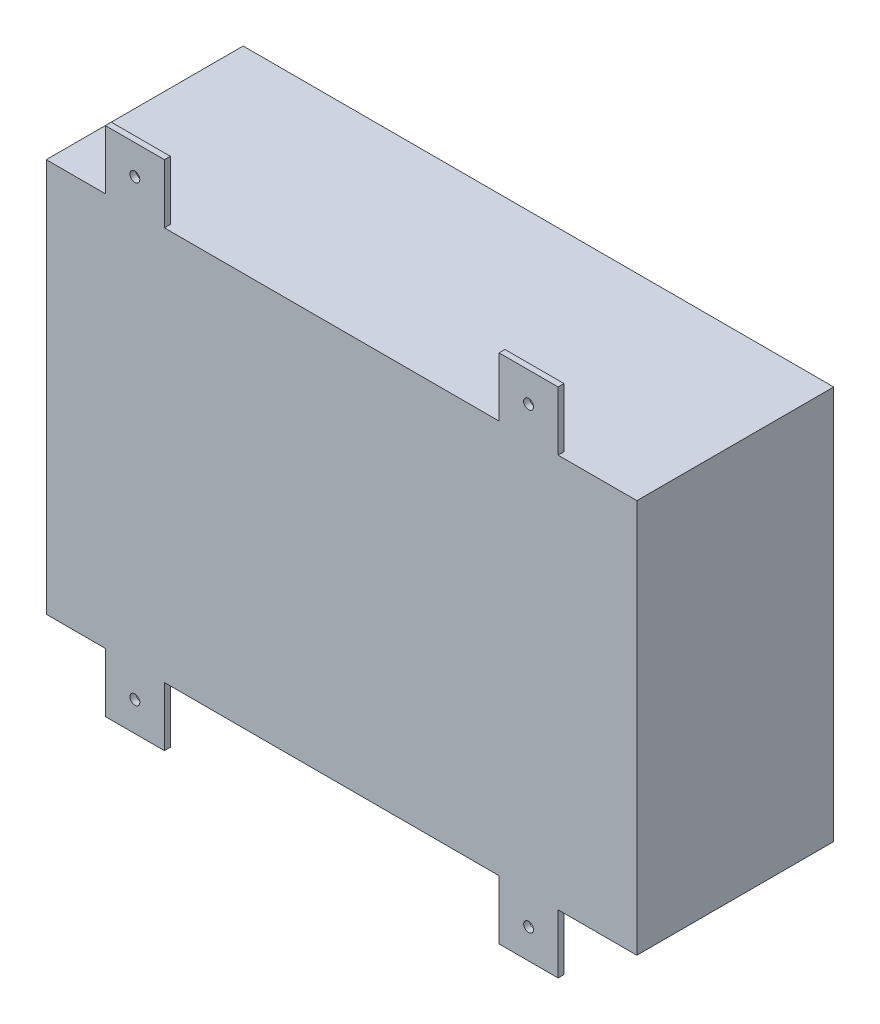
from build123d import *

# Parameters (mm, degrees)
SKETCH1_W           = 762
SKETCH1_H           = 508
SKETCH1_W_2         = 711.2
SKETCH1_H_2         = 457.2
BOSS_EXTRUDE1_DEPTH = 254
SKETCH2_W           = 711.2
SKETCH2_H           = 457.2
BOSS_EXTRUDE2_DEPTH = 25.4
SKETCH3_W           = 76.2
SKETCH3_H           = 76.2
SKETCH3_R           = 6.35
BOSS_EXTRUDE3_DEPTH = 7.62
SKETCH4_R           = 63.5
CUT_EXTRUDE1_DEPTH  = 133.096
SCALE1_SCALE        = 0.5


with BuildPart() as part:
    # Sketch1 → Boss-Extrude1 (new body)
    with BuildSketch(Plane.XY):
        Rectangle(SKETCH1_W, SKETCH1_H)
        Rectangle(SKETCH1_W_2, SKETCH1_H_2, mode=Mode.SUBTRACT)
    extrude(amount=BOSS_EXTRUDE1_DEPTH)

    # Sketch2 → Boss-Extrude2 (add)
    with BuildSketch(Plane.XY.offset(254)):
        Rectangle(SKETCH2_W, SKETCH2_H)
    extrude(amount=-BOSS_EXTRUDE2_DEPTH)

    # Sketch3 → Boss-Extrude3 (add)
    # profile 1 of 4: a face of its own
    with BuildSketch(Plane.XY.offset(254)):
        with Locations((-266.7, -292.1)):
            Rectangle(SKETCH3_W, SKETCH3_H)
        with Locations((-266.7, -292.1)):
            Circle(SKETCH3_R, mode=Mode.SUBTRACT)
    # profile 2 of 4: a face of its own
    with BuildSketch(Plane.XY.offset(254)):
        with Locations((-266.7, 292.1)):
            Rectangle(SKETCH3_W, SKETCH3_H)
        with Locations((-266.7, 292.1)):
            Circle(SKETCH3_R, mode=Mode.SUBTRACT)
    # profile 3 of 4: a face of its own
    with BuildSketch(Plane.XY.offset(254)):
        with Locations((241.3, -292.1)):
            Rectangle(SKETCH3_W, SKETCH3_H)
        with Locations((241.3, -292.1)):
            Circle(SKETCH3_R, mode=Mode.SUBTRACT)
    # profile 4 of 4: a face of its own
    with BuildSketch(Plane.XY.offset(254)):
        with Locations((241.3, 292.1)):
            Rectangle(SKETCH3_W, SKETCH3_H)
        with Locations((241.3, 292.1)):
            Circle(SKETCH3_R, mode=Mode.SUBTRACT)
    extrude(amount=-BOSS_EXTRUDE3_DEPTH)

    # Sketch4 → Cut-Extrude1 (cut)
    with BuildSketch(Plane.XZ.offset(254)):
        with Locations(Location((0, 127, 0), (0, 0, 270))):
            Circle(SKETCH4_R)
    extrude(amount=-CUT_EXTRUDE1_DEPTH, mode=Mode.SUBTRACT)


with BuildPart() as part_1:
    # Scale1: scaled about (0, 0, 0)
    add(part.part.scale(SCALE1_SCALE))


solid = part_1.part
